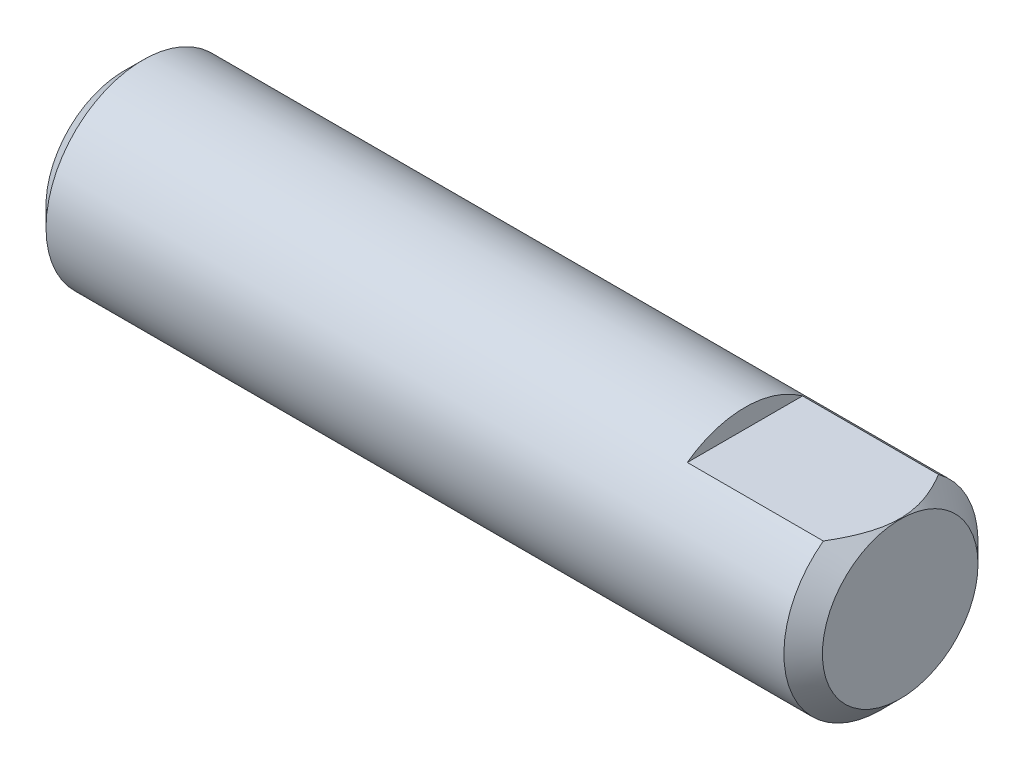
from build123d import *

# Parameters (mm, degrees)
SKETCH1_R      = 3.96875
EXTRUDE1_DEPTH = 31.75
CHAMFER1_SIZE  = 0.7874
SKETCH2_W      = 7.62
SKETCH2_H      = 1.27
EXTRUDE2_DEPTH = 6.35


with BuildPart() as part:
    # Sketch1 → Extrude1 (new body)
    with BuildSketch(Plane(origin=(0, 0, 0), x_dir=(0, 0, -1), z_dir=(1, 0, 0))):
        Circle(SKETCH1_R)
    extrude(amount=EXTRUDE1_DEPTH)

    # Chamfer1
    chamfer1_edges = [part.edges().sort_by_distance(p)[0] for p in [
        (0, 0, 3.96875),
        (31.75, 0, 3.96875),
    ]]
    chamfer(chamfer1_edges, length=CHAMFER1_SIZE)

    # Sketch2 → Extrude2 (cut)
    with BuildSketch(Plane(origin=(31.75, 0, 0), x_dir=(0, 0, -1), z_dir=(1, 0, 0))):
        with Locations((0, 3.82905)):
            Rectangle(SKETCH2_W, SKETCH2_H)
    extrude(amount=-EXTRUDE2_DEPTH, mode=Mode.SUBTRACT)


solid = part.part
